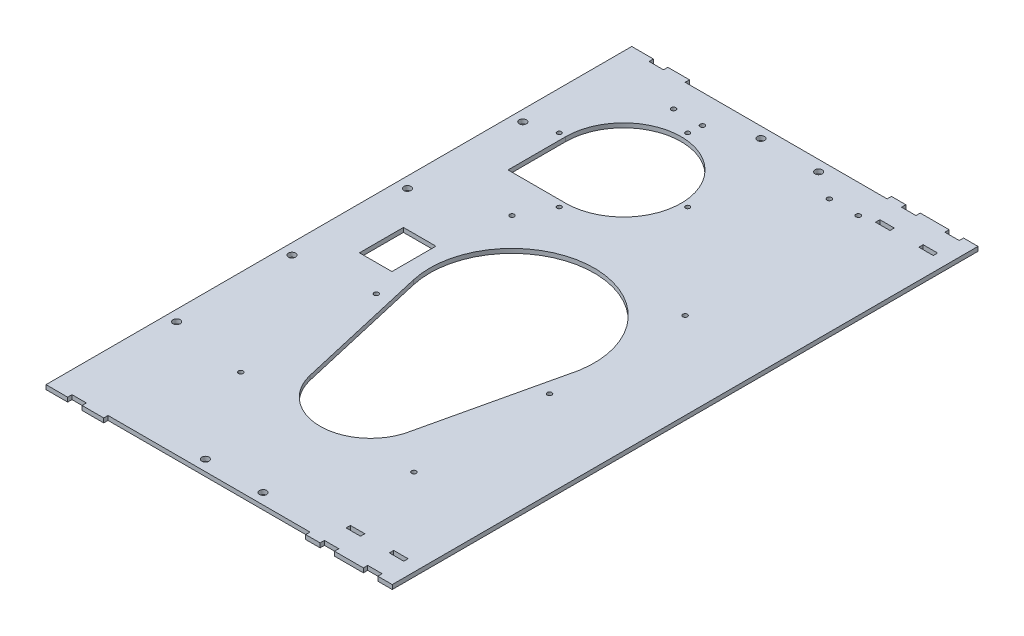
from build123d import *

# Parameters (mm, degrees)
SKETCH_1_W           = 240
SKETCH_1_H           = 400
EXTRUDE_1_DEPTH      = 3
SKETCH_9_W           = 10
SKETCH_9_H           = 3
SKETCH_9_W_2         = 20
SKETCH_9_W_3         = 15
EXTRUDE_2_DEPTH      = 3
SKETCH_13_W          = 10
SKETCH_13_H          = 3
CUT_EXTRUDE_1_DEPTH  = 3
SKETCH_12_R          = 2.5
CUT_EXTRUDE_2_DEPTH  = 3
SKETCH_10_R          = 2.5
CUT_EXTRUDE_3_DEPTH  = 3
SKETCH_14_R          = 1.6
CUT_EXTRUDE_4_DEPTH  = 3
SKETCH_23_R          = 1.5
CUT_EXTRUDE_11_DEPTH = 10
SKETCH_21_W          = 22.5
SKETCH_21_H          = 30.5
CUT_EXTRUDE_12_DEPTH = 10
SKETCH_24_R          = 1.625
CUT_EXTRUDE_13_DEPTH = 10


with BuildPart() as part:
    # 草图1 → 凸台-拉伸1 (new body)
    with BuildSketch(Plane(origin=(46.742818835, 0, -86.416508262), x_dir=(1, 0, 0), z_dir=(0, 1, 0))):
        with Locations((-16.707557602, -86.429149101)):
            Rectangle(SKETCH_1_W, SKETCH_1_H)
    extrude(amount=EXTRUDE_1_DEPTH)

    # 草图9 → 凸台-拉伸2 (add)
    with BuildSketch(Plane(origin=(0, 3, 0), x_dir=(1, 0, 0), z_dir=(0, 1, 0))):
        with Locations((145.035261234, -201.512640839)):
            Rectangle(SKETCH_9_W, SKETCH_9_H)
        with Locations((120.035261234, -201.512640839)):
            Rectangle(SKETCH_9_W_2, SKETCH_9_H)
        with Locations((95.035261234, -201.512640839)):
            Rectangle(SKETCH_9_W, SKETCH_9_H)
        with Locations((145.035261234, 201.487359161)):
            Rectangle(SKETCH_9_W, SKETCH_9_H)
        with Locations((120.035261234, 201.487359161)):
            Rectangle(SKETCH_9_W_2, SKETCH_9_H)
        with Locations((95.035261234, 201.487359161)):
            Rectangle(SKETCH_9_W, SKETCH_9_H)
        with Locations((-57.464738766, 201.487359161)):
            Rectangle(SKETCH_9_W_3, SKETCH_9_H)
        with Locations((-82.464738766, -201.512640839)):
            Rectangle(SKETCH_9_W_3, SKETCH_9_H)
        with Locations((-57.464738766, -201.512640839)):
            Rectangle(SKETCH_9_W_3, SKETCH_9_H)
        with Locations((-82.464738766, 201.487359161)):
            Rectangle(SKETCH_9_W_3, SKETCH_9_H)
    extrude(amount=-EXTRUDE_2_DEPTH)

    # 草图13 → 切除-拉伸1 (cut)
    with BuildSketch(Plane(origin=(0, 3, 0), x_dir=(1, 0, 0), z_dir=(0, 1, 0))):
        with Locations((135.035261234, -183.512640839)):
            Rectangle(SKETCH_13_W, SKETCH_13_H)
        with Locations((105.035261234, -183.512640839)):
            Rectangle(SKETCH_13_W, SKETCH_13_H)
        with Locations((135.035261234, 183.487359161)):
            Rectangle(SKETCH_13_W, SKETCH_13_H)
        with Locations((105.035261234, 183.487359161)):
            Rectangle(SKETCH_13_W, SKETCH_13_H)
    extrude(amount=-CUT_EXTRUDE_1_DEPTH, mode=Mode.SUBTRACT)

    # 草图12 → 切除-拉伸2 (cut)
    with BuildSketch(Plane(origin=(0, 3, 0), x_dir=(1, 0, 0), z_dir=(0, 1, 0))):
        with Locations(Location((-82.464738766, -120.012640839, 0), (0, 0, 270))):
            Circle(SKETCH_12_R)
        with Locations(Location((-82.464738766, -40.012640839, 0), (0, 0, 270))):
            Circle(SKETCH_12_R)
        with Locations(Location((-82.464738766, 119.987359161, 0), (0, 0, 270))):
            Circle(SKETCH_12_R)
        with Locations(Location((-82.464738766, 39.987359161, 0), (0, 0, 270))):
            Circle(SKETCH_12_R)
    extrude(amount=-CUT_EXTRUDE_2_DEPTH, mode=Mode.SUBTRACT)

    # 草图10 → 切除-拉伸3 (cut)
    with BuildSketch(Plane(origin=(0, 3, 0), x_dir=(1, 0, 0), z_dir=(0, 1, 0))):
        with Locations(Location((50.035261234, -192.512640839, 0), (0, 0, 270))):
            Circle(SKETCH_10_R)
        with Locations(Location((10.035261234, -192.512640839, 0), (0, 0, 270))):
            Circle(SKETCH_10_R)
        with Locations(Location((50.055539801, 192.497892125, 0), (0, 0, 90))):
            Circle(SKETCH_10_R)
        with Locations(Location((10.055540023, 192.502105738, 0), (0, 0, 90))):
            Circle(SKETCH_10_R)
    extrude(amount=-CUT_EXTRUDE_3_DEPTH, mode=Mode.SUBTRACT)

    # 草图14 → 切除-拉伸4 (cut)
    with BuildSketch(Plane(origin=(0, 3, 0), x_dir=(1, 0, 0), z_dir=(0, 1, 0))):
        with Locations(Location((90.035261234, -34.012640839, 0), (0, 0, 270))):
            Circle(SKETCH_14_R)
        with Locations(Location((-29.964738766, -34.012640839, 0), (0, 0, 90))):
            Circle(SKETCH_14_R)
        with Locations(Location((90.035261234, -128.012640839, 0), (0, 0, 270))):
            Circle(SKETCH_14_R)
        with Locations(Location((-29.964738766, -128.012640839, 0), (0, 0, 90))):
            Circle(SKETCH_14_R)
        with Locations(Location((-29.964738766, 59.987359161, 0), (0, 0, 270))):
            Circle(SKETCH_14_R)
        with Locations(Location((90.035261234, 59.987359161, 0), (0, 0, 90))):
            Circle(SKETCH_14_R)
        with BuildLine():
            Line((-4.071414156, -105.869783696), (-25.509895829, -12.808559206))
            ThreePointArc((-25.509895829, -12.808559206), (28.551489229, 56.968043789), (86.171099154, -9.900395941))
            Line((86.171099154, -9.900395941), (64.504635396, -104.08406941))
            ThreePointArc((64.504635396, -104.08406941), (30.946349307, -133.000780522), (-4.071414156, -105.869783696))
        make_face()
    extrude(amount=-CUT_EXTRUDE_4_DEPTH, mode=Mode.SUBTRACT)

    # 草图23 → 切除-拉伸11 (cut)
    with BuildSketch(Plane(origin=(0, 3, 0), x_dir=(1, 0, 0), z_dir=(0, 1, 0))):
        with Locations(Location((-18.714738766, 170.487359161, 0), (0, 0, 270))):
            Circle(SKETCH_23_R)
        with Locations(Location((25.785261234, 125.987359161, 0), (0, 0, 270))):
            Circle(SKETCH_23_R)
        with Locations(Location((-18.714738766, 81.487359161, 0), (0, 0, 270))):
            Circle(SKETCH_23_R)
        with Locations(Location((-63.214738766, 125.987359161, 0), (0, 0, 270))):
            Circle(SKETCH_23_R)
        with BuildLine():
            Line((-58.714738766, 125.987359161), (-58.714738766, 85.987359161))
            Line((-58.714738766, 85.987359161), (-18.714738766, 85.987359161))
            ThreePointArc((-18.714738766, 85.987359161), (9.569532481, 154.271630409), (-58.714738766, 125.987359161))
        make_face()
    extrude(amount=-CUT_EXTRUDE_11_DEPTH, mode=Mode.SUBTRACT)

    # 草图21 → 切除-拉伸12 (cut)
    with BuildSketch(Plane(origin=(0, 3, 0), x_dir=(1, 0, 0), z_dir=(0, 1, 0))):
        with Locations((-49.214738766, -0.012640839)):
            Rectangle(SKETCH_21_W, SKETCH_21_H)
    extrude(amount=-CUT_EXTRUDE_12_DEPTH, mode=Mode.SUBTRACT)

    # 草图24 → 切除-拉伸13 (cut)
    with BuildSketch(Plane.XZ):
        with Locations(Location((-37.964738766, -179.987359161, 0), (0, 0, 270))):
            Circle(SKETCH_24_R)
        with Locations(Location((-17.964738766, -179.987359161, 0), (0, 0, 270))):
            Circle(SKETCH_24_R)
        with Locations(Location((90.035261234, -179.987359161, 0), (0, 0, 270))):
            Circle(SKETCH_24_R)
        with Locations(Location((70.035261234, -179.987359161, 0), (0, 0, 270))):
            Circle(SKETCH_24_R)
    extrude(amount=-CUT_EXTRUDE_13_DEPTH, mode=Mode.SUBTRACT)


solid = part.part
